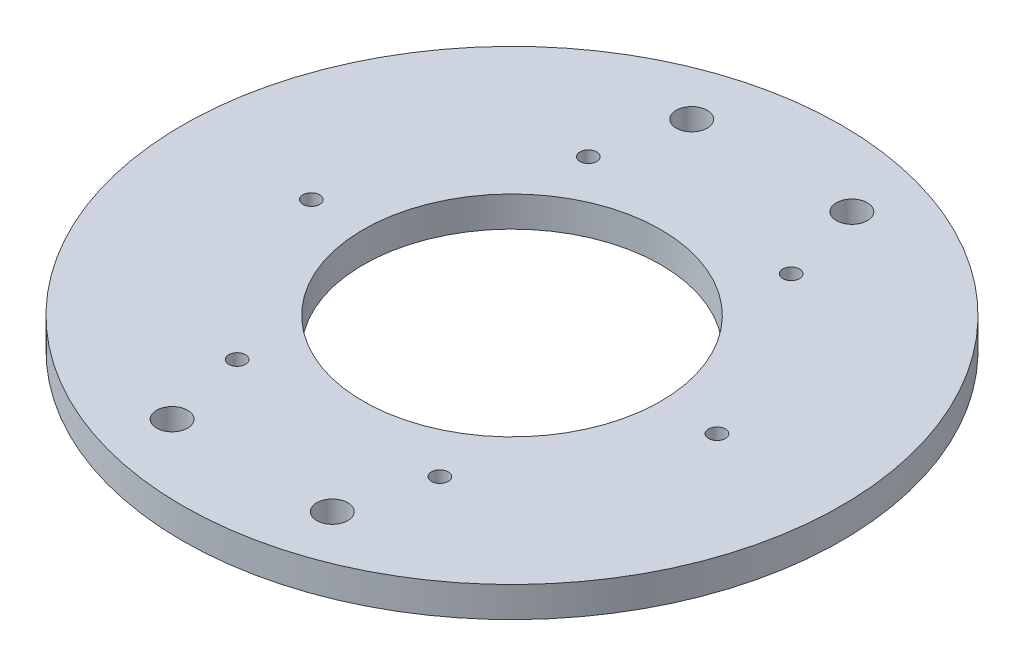
from build123d import *

# Parameters (mm, degrees)
SKETCH1_R               = 41.275
SKETCH1_R_2             = 18.6309
BOSS_EXTRUDE1_DEPTH     = 3.81
CUT_EXTRUDE1_DEPTH      = 59.495874641
CUT_EXTRUDE1_DEPTH_BACK = 59.495874641
SKETCH3_R               = 1.049274
CUT_EXTRUDE2_DEPTH      = 59.495874641
CUT_EXTRUDE2_DEPTH_BACK = 59.495874641
SKETCH4_R               = 1.9431


with BuildPart() as part:
    # Sketch1 → Boss-Extrude1 (new body)
    with BuildSketch(Plane(origin=(0, 0, 0), x_dir=(1, 0, 0), z_dir=(0, 1, 0))):
        with Locations(Location((0, 0, 0), (0, 0, 90))):
            Circle(SKETCH1_R)
        with Locations(Location((0, 0, 0), (0, 0, 90))):
            Circle(SKETCH1_R_2, mode=Mode.SUBTRACT)
    extrude(amount=BOSS_EXTRUDE1_DEPTH)

    # Sketch3 → Cut-Extrude1 (cut, two sides: drawn at the far end of the back side and taken through both)
    with BuildSketch(Plane.XZ.offset(-CUT_EXTRUDE1_DEPTH_BACK)):
        with Locations(Location((12.96732128, 21.997045256, 0), (0, 0, 270))):
            Circle(SKETCH3_R)
        with Locations(Location((-12.43267872, 21.997045256, 0), (0, 0, 270))):
            Circle(SKETCH3_R)
        with Locations(Location((-25.13267872, 0, 0), (0, 0, 270))):
            Circle(SKETCH3_R)
        with Locations(Location((-12.43267872, -21.997045256, 0), (0, 0, 270))):
            Circle(SKETCH3_R)
        with Locations(Location((12.96732128, -21.997045256, 0), (0, 0, 270))):
            Circle(SKETCH3_R)
        with Locations(Location((25.66732128, 0, 0), (0, 0, 270))):
            Circle(SKETCH3_R)
    extrude(amount=CUT_EXTRUDE1_DEPTH + CUT_EXTRUDE1_DEPTH_BACK, mode=Mode.SUBTRACT)

    # Sketch4 → Cut-Extrude2 (cut, two sides: drawn at the far end of the back side and taken through both)
    with BuildSketch(Plane(origin=(0, 3.81, 0), x_dir=(1, 0, 0), z_dir=(0, 1, 0)).offset(-CUT_EXTRUDE2_DEPTH_BACK)):
        with Locations(Location((-10.031528943, 32.5374, 0), (0, 0, 270))):
            Circle(SKETCH4_R)
        with Locations(Location((-10.031528943, -32.5374, 0), (0, 0, 270))):
            Circle(SKETCH4_R)
        with Locations(Location((10.031528943, -32.5374, 0), (0, 0, 270))):
            Circle(SKETCH4_R)
        with Locations(Location((10.031528943, 32.5374, 0), (0, 0, 270))):
            Circle(SKETCH4_R)
    extrude(amount=CUT_EXTRUDE2_DEPTH + CUT_EXTRUDE2_DEPTH_BACK, mode=Mode.SUBTRACT)


solid = part.part
